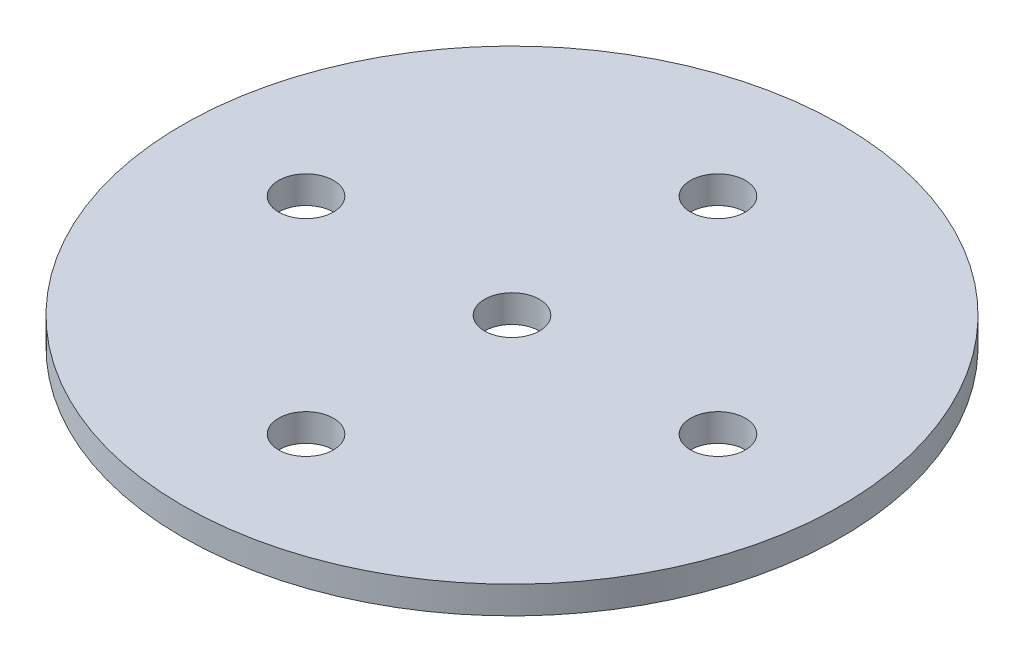
from build123d import *

# Parameters (mm, degrees)
SKETCH1_R           = 120
SKETCH1_R_2         = 10
BOSS_EXTRUDE1_DEPTH = 10


with BuildPart() as part:
    # Sketch1 → Boss-Extrude1 (new body)
    with BuildSketch(Plane(origin=(0, 0, 0), x_dir=(1, 0, 0), z_dir=(0, 1, 0))):
        with Locations(Location((0, 0, 0), (0, 0, 270))):
            Circle(SKETCH1_R)
        with Locations(Location((0, 0, 0), (0, 0, 270))):
            Circle(SKETCH1_R_2, mode=Mode.SUBTRACT)
        with Locations(Location((75, 0, 0), (0, 0, 270))):
            Circle(SKETCH1_R_2, mode=Mode.SUBTRACT)
        with Locations(Location((0, -75, 0), (0, 0, 270))):
            Circle(SKETCH1_R_2, mode=Mode.SUBTRACT)
        with Locations(Location((-75, 0, 0), (0, 0, 270))):
            Circle(SKETCH1_R_2, mode=Mode.SUBTRACT)
        with Locations(Location((0, 75, 0), (0, 0, 270))):
            Circle(SKETCH1_R_2, mode=Mode.SUBTRACT)
    extrude(amount=BOSS_EXTRUDE1_DEPTH)


solid = part.part
